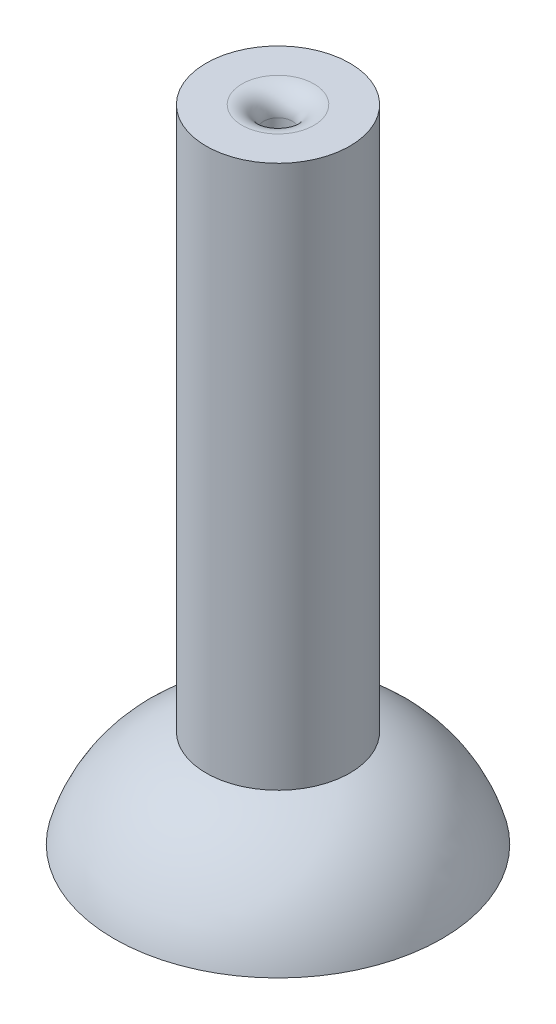
from build123d import *

# Parameters (mm, degrees)
CUT_EXTRUDE1_DEPTH = 5
FILLET1_R          = 1.5


with BuildPart() as part:
    # Sketch1 → Revolve1 (revolve)
    with BuildSketch(Plane.XY, mode=Mode.PRIVATE) as revolve1_sk:
        with BuildLine():
            Line((-1, 35), (0, 35))
            Line((0, 35), (0, 0))
            Line((0, 0), (-3.000286873, 0))
            Line((-3.000286873, 0), (-4.983763516, 0.703110012))
            ThreePointArc((-4.983763516, 0.703110012), (-8.025665426, -1.379057303), (-9.900003631, -4.553241332))
            Line((-9.900003631, -4.553241332), (-11.400003631, -4.553241332))
            ThreePointArc((-11.400003631, -4.553241332), (-9.044878062, -0.365029449), (-5, 2.228558162))
            Line((-5, 2.228558162), (-5, 40))
            Line((-5, 40), (-1, 40))
            Line((-1, 40), (-1, 35))
        make_face()
    revolve(revolve1_sk.sketch.rotate(Axis((0, -4.474343066, 0), (0, 1, 0)), 270), axis=Axis((0, -4.474343066, 0), (0, 1, 0)))

    # Sketch2 → Cut-Extrude1 (cut)
    with BuildSketch(Plane.XZ):
        with BuildLine():
            ThreePointArc((1.5, 2), (0, 2.5), (-1.5, 2))
            Line((-1.5, 2), (1.5, 2))
        make_face()
        Polygon((-1.5, 2), (1.5, 2), (1.5, -2), align=None)
        Polygon((-1.5, 2), (1.5, -2), (-1.5, -2), align=None)
        with BuildLine():
            ThreePointArc((-1.5, -2), (0, -2.5), (1.5, -2))
            Line((1.5, -2), (-1.5, -2))
        make_face()
    extrude(amount=-CUT_EXTRUDE1_DEPTH, mode=Mode.SUBTRACT)

    # Fillet1
    fillet1_edges = [part.edges().sort_by_distance(p)[0] for p in [
        (0, 40, 1),
    ]]
    fillet(fillet1_edges, radius=FILLET1_R)


solid = part.part
